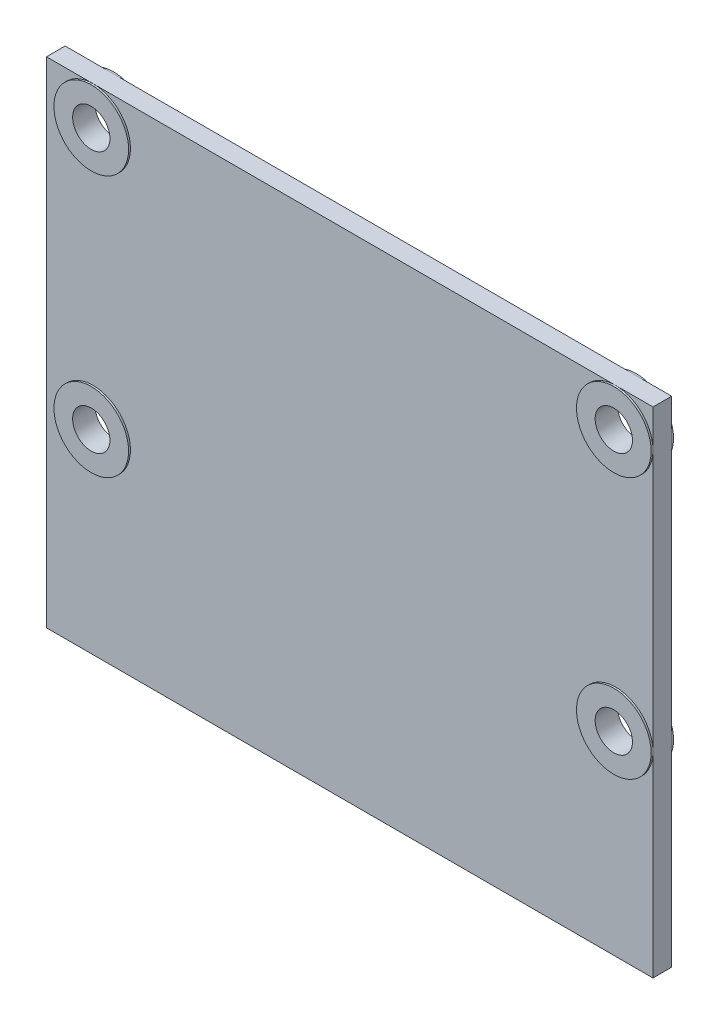
from build123d import *

# Parameters (mm, degrees)
SKETCH1_W                = 32.5
SKETCH1_H                = 26.5
BOSS_EXTRUDE1_DEPTH      = 1
SKETCH2_R                = 1
CUT_EXTRUDE1_DEPTH       = 2
BOSS_EXTRUDE3_DEPTH      = 0.1
BOSS_EXTRUDE3_DEPTH_BACK = 1.1
SKETCH3_R                = 2
SKETCH3_R_2              = 1


with BuildPart() as part:
    # Sketch1 → Boss-Extrude1 (new body)
    with BuildSketch(Plane.XY):
        Rectangle(SKETCH1_W, SKETCH1_H)
    extrude(amount=BOSS_EXTRUDE1_DEPTH)

    # Sketch2 → Cut-Extrude1 (cut)
    with BuildSketch(Plane.XY.offset(1)):
        with Locations((-13.75, 11.25)):
            Circle(SKETCH2_R)
        with Locations((-13.75, -2.75)):
            Circle(SKETCH2_R)
        with Locations((14.25, -2.75)):
            Circle(SKETCH2_R)
        with Locations((14.25, 11.25)):
            Circle(SKETCH2_R)
    extrude(amount=-CUT_EXTRUDE1_DEPTH, mode=Mode.SUBTRACT)

    # Sketch3 → Boss-Extrude3 (add, two sides: drawn at the far end of the back side and taken through both)
    # profile 1 of 4: a face of its own
    with BuildSketch(Plane.XY.offset(1).offset(-BOSS_EXTRUDE3_DEPTH_BACK)):
        with Locations((-13.75, 11.25)):
            Circle(SKETCH3_R)
        with Locations((-13.75, 11.25)):
            Circle(SKETCH3_R_2, mode=Mode.SUBTRACT)
    # profile 2 of 4: a face of its own
    with BuildSketch(Plane.XY.offset(1).offset(-BOSS_EXTRUDE3_DEPTH_BACK)):
        with Locations((14.25, 11.25)):
            Circle(SKETCH3_R)
        with Locations((14.25, 11.25)):
            Circle(SKETCH3_R_2, mode=Mode.SUBTRACT)
    # profile 3 of 4: a face of its own
    with BuildSketch(Plane.XY.offset(1).offset(-BOSS_EXTRUDE3_DEPTH_BACK)):
        with Locations((14.25, -2.75)):
            Circle(SKETCH3_R)
        with Locations((14.25, -2.75)):
            Circle(SKETCH3_R_2, mode=Mode.SUBTRACT)
    # profile 4 of 4: a face of its own
    with BuildSketch(Plane.XY.offset(1).offset(-BOSS_EXTRUDE3_DEPTH_BACK)):
        with Locations((-13.75, -2.75)):
            Circle(SKETCH3_R)
        with Locations((-13.75, -2.75)):
            Circle(SKETCH3_R_2, mode=Mode.SUBTRACT)
    extrude(amount=BOSS_EXTRUDE3_DEPTH + BOSS_EXTRUDE3_DEPTH_BACK)


solid = part.part
